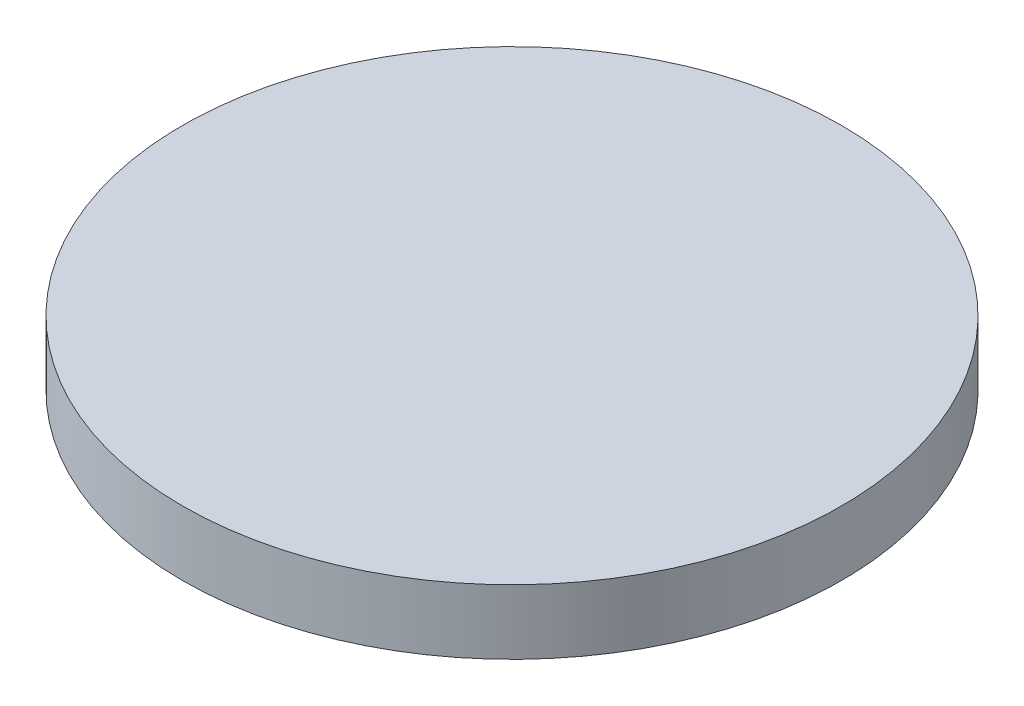
from build123d import *

# Parameters (mm, degrees)
SKETCH2_R           = 25.5
BOSS_EXTRUDE1_DEPTH = 5


with BuildPart() as part:
    # Sketch2 → Boss-Extrude1 (new body)
    with BuildSketch(Plane(origin=(0, 0, 0), x_dir=(1, 0, 0), z_dir=(0, 1, 0))):
        with Locations(Location((0, 0, 0), (0, 0, 270))):
            Circle(SKETCH2_R)
    extrude(amount=BOSS_EXTRUDE1_DEPTH)


solid = part.part
